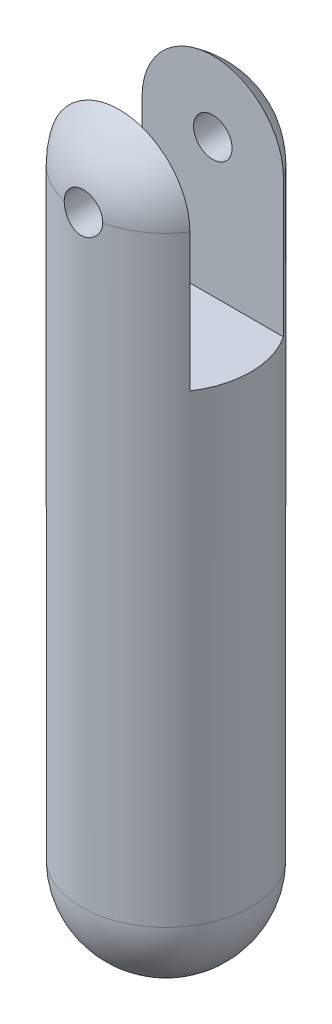
from build123d import *

# Parameters (mm, degrees)
CUT_EXTRUDE1_DEPTH      = 17.064109466
CUT_EXTRUDE1_DEPTH_BACK = 17.064109466
SKETCH2_W               = 2.159
SKETCH2_H               = 5.314367205
CUT_EXTRUDE2_DEPTH      = 17.064109466
CUT_EXTRUDE2_DEPTH_BACK = 17.064109466
SKETCH3_R               = 0.4445


with BuildPart() as part:
    # Sketch1 one side → Revolve1 (revolve)
    with BuildSketch(Plane.XY):
        with BuildLine():
            Line((1.9558, -13.8684), (1.9558, 0))
            ThreePointArc((1.9558, 0), (1.382959443, 1.382959443), (0, 1.9558))
            Line((0, 1.9558), (0, -15.8242))
            ThreePointArc((0, -15.8242), (1.382959443, -15.251359443), (1.9558, -13.8684))
        make_face()
    revolve(axis=Axis((0, 0, 0), (0, -1, 0)))

    # Sketch2 → Cut-Extrude1 (cut, two sides: drawn at the far end of the back side and taken through both)
    with BuildSketch(Plane(origin=(0, 0, 0), x_dir=(0, 0, -1), z_dir=(1, 0, 0)).offset(-CUT_EXTRUDE1_DEPTH_BACK)):
        with Locations((0, -0.517816398)):
            Rectangle(SKETCH2_W, SKETCH2_H)
    extrude(amount=CUT_EXTRUDE1_DEPTH + CUT_EXTRUDE1_DEPTH_BACK, mode=Mode.SUBTRACT)

    # Sketch3 → Cut-Extrude2 (cut, two sides: drawn at the far end of the back side and taken through both)
    with BuildSketch(Plane.XY.offset(-CUT_EXTRUDE2_DEPTH_BACK)):
        Circle(SKETCH3_R)
    extrude(amount=CUT_EXTRUDE2_DEPTH + CUT_EXTRUDE2_DEPTH_BACK, mode=Mode.SUBTRACT)


solid = part.part
